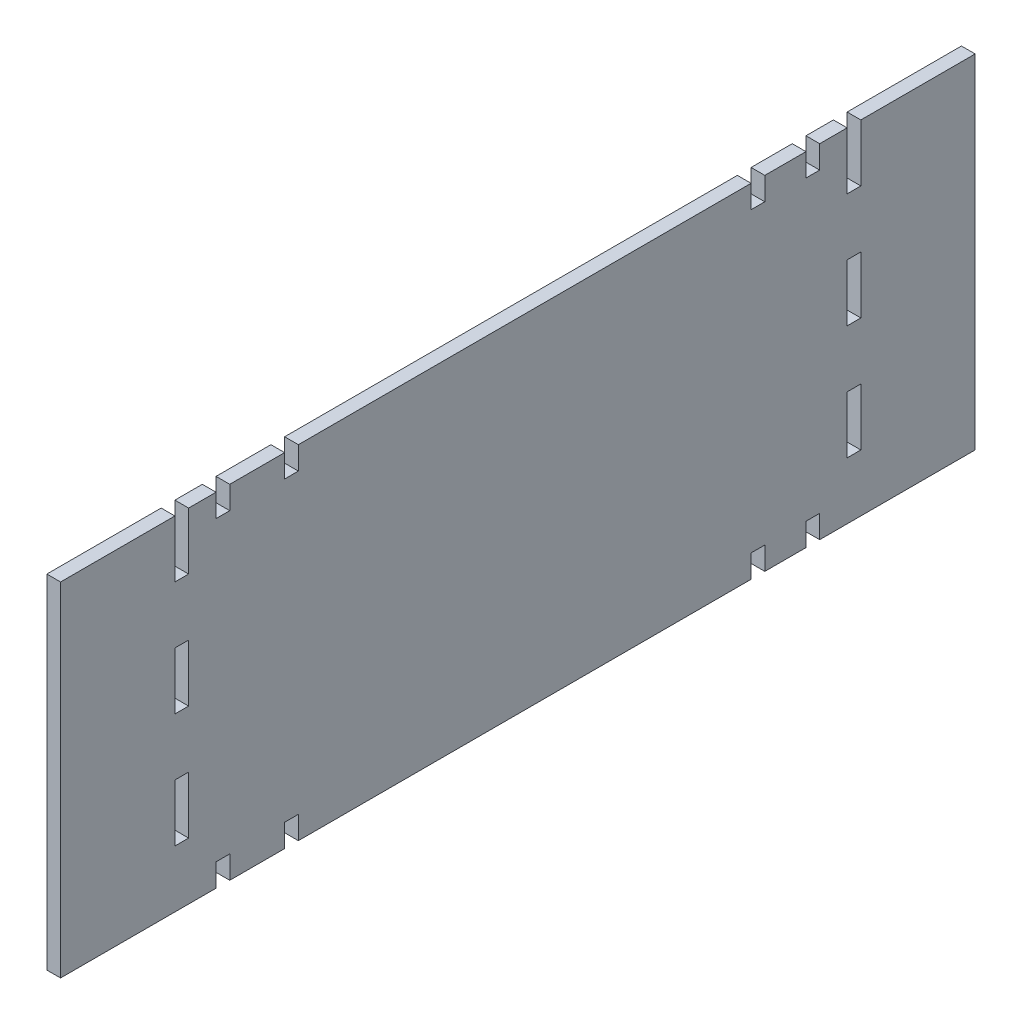
from build123d import *

# Parameters (mm, degrees)
SKETCH1_W            = 400
SKETCH1_H            = 150
BOSS_EXTRUDE1_DEPTH  = 6
SKETCH3_W            = 6
SKETCH3_H            = 25
CUT_EXTRUDE1_DEPTH   = 428.242320001
LPATTERN1_COUNT      = 2
LPATTERN1_PITCH      = 294
LPATTERN1_COUNT_DIR2 = 3
LPATTERN1_PITCH_DIR2 = 50
SKETCH4_W            = 6
SKETCH4_H            = 10
CUT_EXTRUDE2_DEPTH   = 428.242320001
LPATTERN2_COUNT      = 2
LPATTERN2_PITCH      = 258
LPATTERN2_COUNT_DIR2 = 2
LPATTERN2_PITCH_DIR2 = 140
SKETCH5_W            = 6
SKETCH5_H            = 10
CUT_EXTRUDE3_DEPTH   = 428.242320001
LPATTERN3_COUNT      = 2
LPATTERN3_PITCH      = 140
LPATTERN3_COUNT_DIR2 = 2
LPATTERN3_PITCH_DIR2 = 204


with BuildPart() as part:
    # Sketch1 → Boss-Extrude1 (new body)
    with BuildSketch(Plane(origin=(0, 0, 0), x_dir=(0, 0, -1), z_dir=(1, 0, 0))):
        with Locations((-200, 75)):
            Rectangle(SKETCH1_W, SKETCH1_H)
    extrude(amount=BOSS_EXTRUDE1_DEPTH)

    # Sketch3 → Cut-Extrude1 (cut, through all)
    with BuildSketch(Plane(origin=(6, 0, 0), x_dir=(0, 0, -1), z_dir=(1, 0, 0))):
        with Locations((-347, 137.5)):
            Rectangle(SKETCH3_W, SKETCH3_H)
    cut_extrude1 = extrude(amount=-CUT_EXTRUDE1_DEPTH, mode=Mode.SUBTRACT)

    # LPattern1: Cut-Extrude1 2 × 3
    with Locations(*[(0, -j * LPATTERN1_PITCH_DIR2, -i * LPATTERN1_PITCH) for i in range(LPATTERN1_COUNT) for j in range(LPATTERN1_COUNT_DIR2) if (i, j) != (0, 0)]):
        add(cut_extrude1, mode=Mode.SUBTRACT)

    # Sketch4 → Cut-Extrude2 (cut, through all)
    with BuildSketch(Plane(origin=(6, 0, 0), x_dir=(0, 0, -1), z_dir=(1, 0, 0))):
        with Locations((-329, 145)):
            Rectangle(SKETCH4_W, SKETCH4_H)
    cut_extrude2 = extrude(amount=-CUT_EXTRUDE2_DEPTH, mode=Mode.SUBTRACT)

    # LPattern2: Cut-Extrude2 2 × 2
    with Locations(*[(0, -j * LPATTERN2_PITCH_DIR2, -i * LPATTERN2_PITCH) for i in range(LPATTERN2_COUNT) for j in range(LPATTERN2_COUNT_DIR2) if (i, j) != (0, 0)]):
        add(cut_extrude2, mode=Mode.SUBTRACT)

    # Sketch5 → Cut-Extrude3 (cut, through all)
    with BuildSketch(Plane(origin=(6, 0, 0), x_dir=(0, 0, -1), z_dir=(1, 0, 0))):
        with Locations((-299, 145)):
            Rectangle(SKETCH5_W, SKETCH5_H)
    cut_extrude3 = extrude(amount=-CUT_EXTRUDE3_DEPTH, mode=Mode.SUBTRACT)

    # LPattern3: Cut-Extrude3 2 × 2
    with Locations(*[(0, -i * LPATTERN3_PITCH, -j * LPATTERN3_PITCH_DIR2) for i in range(LPATTERN3_COUNT) for j in range(LPATTERN3_COUNT_DIR2) if (i, j) != (0, 0)]):
        add(cut_extrude3, mode=Mode.SUBTRACT)


solid = part.part
